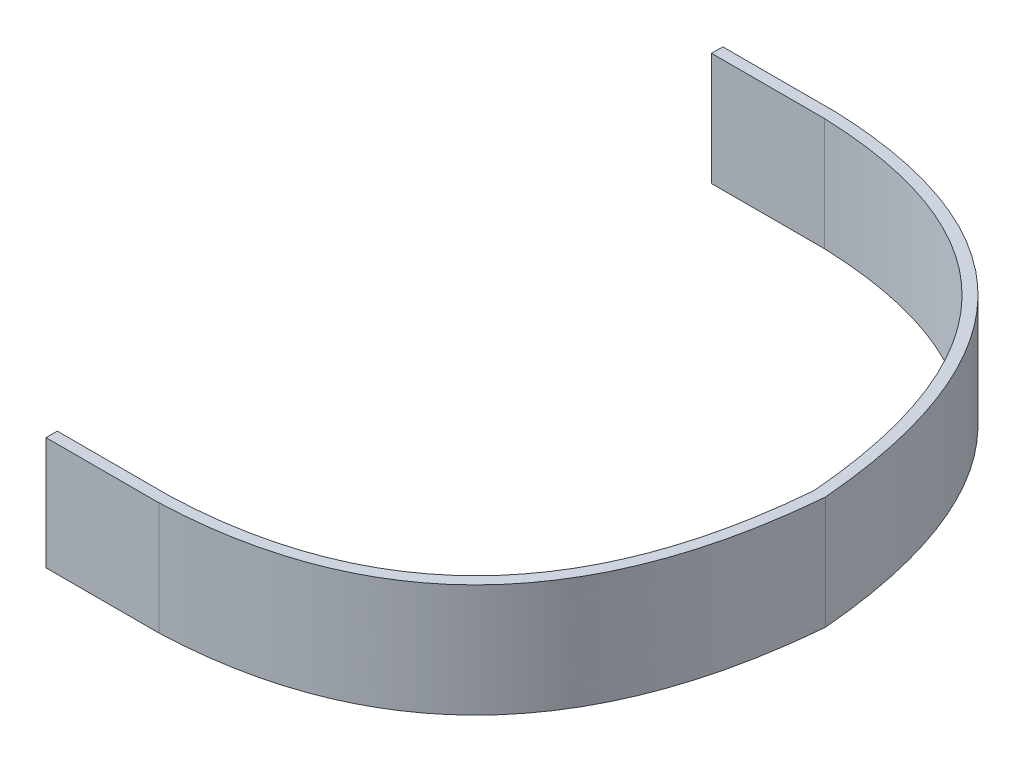
from build123d import *

# Parameters (mm, degrees)
BOSS_EXTRUDE1_DEPTH = 30


with BuildPart() as part:
    # Sketch2 → Boss-Extrude1 (new body)
    with BuildSketch(Plane(origin=(0, 0, 0), x_dir=(1, 0, 0), z_dir=(0, 1, 0))):
        with BuildLine():
            Line((0, 90), (-30, 90))
            Line((-30, 90), (-30, 87))
            Line((-30, 87), (0, 87))
            add(Edge.make_bspline(
                [(0, 87), (77.34675255, 84.211391956), (84.31600038, 0)],
                knots=[0, 0, 0, 1, 1, 1], degree=2))
            add(Edge.make_bspline(
                [(0, -87), (77.34675255, -84.211391956), (84.31600038, 0)],
                knots=[0, 0, 0, 1, 1, 1], degree=2))
            Line((0, -87), (-30, -87))
            Line((-30, -87), (-30, -90))
            Line((-30, -90), (0, -90))
            add(Edge.make_bspline(
                [(0, -90), (79.973883015, -87.051000651), (87.31600038, 0)],
                knots=[0, 0, 0, 1, 1, 1], degree=2))
            add(Edge.make_bspline(
                [(0, 90), (79.973883015, 87.051000651), (87.31600038, 0)],
                knots=[0, 0, 0, 1, 1, 1], degree=2))
        make_face()
    extrude(amount=BOSS_EXTRUDE1_DEPTH)


solid = part.part
